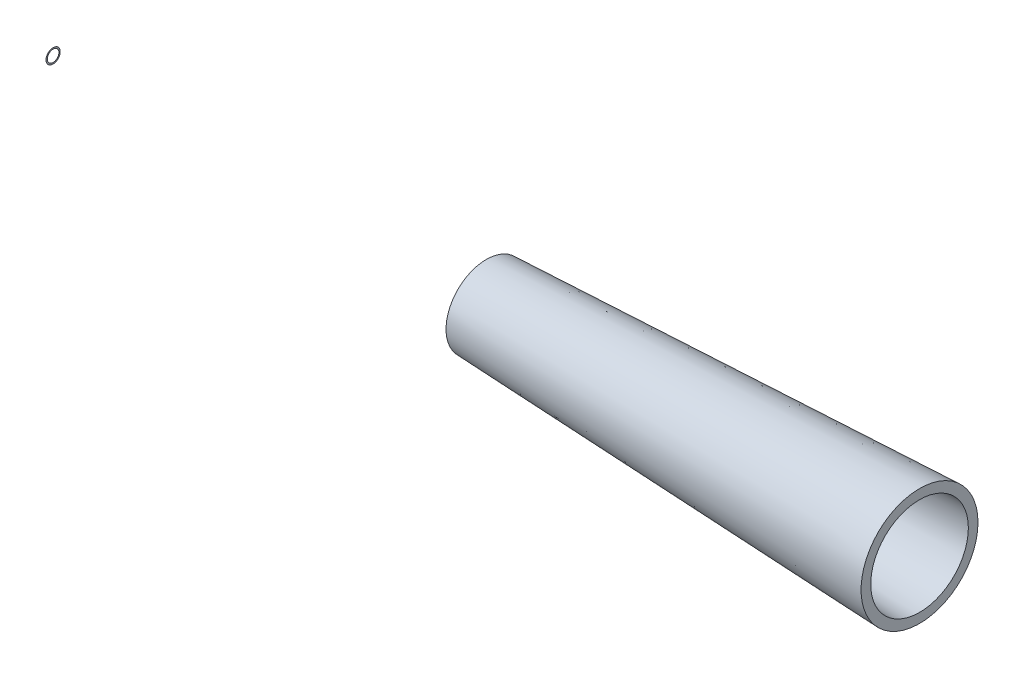
from build123d import *


with BuildPart() as part:
    # Sketch2 → Revolve2 (revolve)
    with BuildSketch(Plane.XY, mode=Mode.PRIVATE) as revolve2_sk:
        with BuildLine():
            Line((0, 1.2), (50, 4.696340597))
            Line((50, 4.696340597), (50, 6.696340597))
            Line((50, 6.696340597), (1.851094968, 3.32944117))
            ThreePointArc((1.851094968, 3.32944117), (0.484525778, 2.648094905), (0, 1.2))
        make_face()
    revolve(revolve2_sk.sketch.rotate(Axis((-19.275847123, 0, 0), (1, 0, 0)), 90), axis=Axis((-19.275847123, 0, 0), (1, 0, 0)))

    # SurfaceCut9
    split(bisect_by=Plane(origin=(0, 0, 0), x_dir=(0, 0, -1), z_dir=(1, 0, 0)), keep=Keep.BOTTOM)


with BuildPart() as body_2:
    # Sketch3 → Revolve3 (revolve)
    with BuildSketch(Plane.XY, mode=Mode.PRIVATE) as revolve3_sk:
        Polygon((50, 4.694584717), (180, 10.143199062), (180, 12.144954942), (50, 6.696340597), align=None)
    revolve(revolve3_sk.sketch.rotate(Axis((50, 0, 0), (-1, 0, 0)), 90), axis=Axis((50, 0, 0), (-1, 0, 0)))

    # SurfaceCut12
    split(bisect_by=Plane(origin=(90, 0, 0), x_dir=(0, 0, -1), z_dir=(1, 0, 0)), keep=Keep.TOP)


solid = Compound([part.part, body_2.part])
